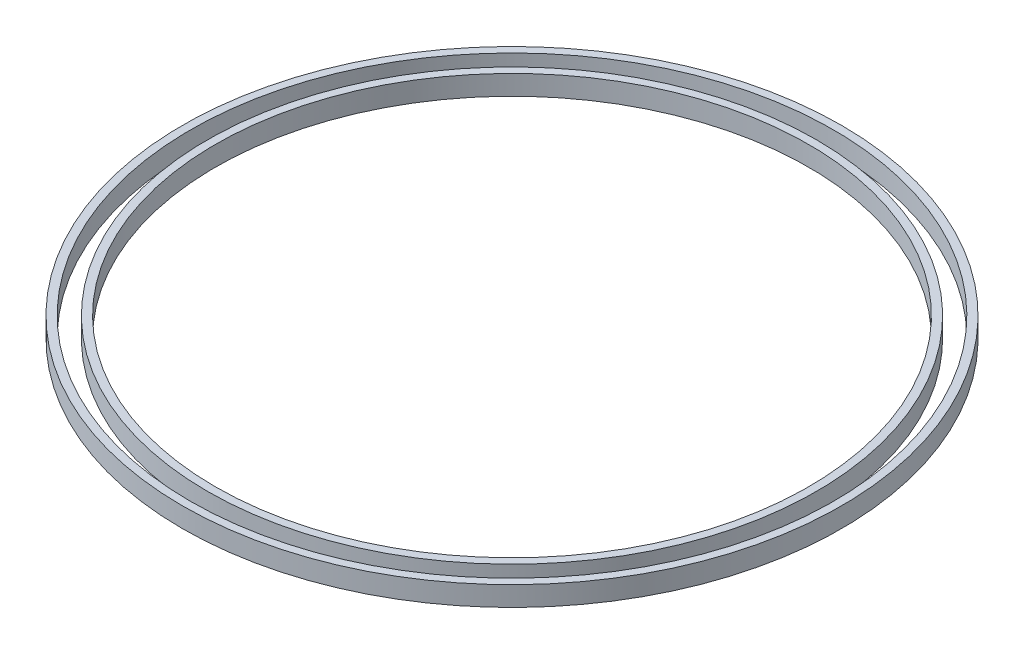
from build123d import *

# Parameters (mm, degrees)
SKETCH1_R           = 46.2
SKETCH1_R_2         = 45
BOSS_EXTRUDE1_DEPTH = 3
SKETCH2_R           = 50
SKETCH2_R_2         = 48.8
BOSS_EXTRUDE2_DEPTH = 3
CUT_EXTRUDE1_DEPTH  = 0.4


with BuildPart() as part:
    # Sketch1 → Boss-Extrude1 (new body)
    with BuildSketch(Plane(origin=(0, 0, 0), x_dir=(1, 0, 0), z_dir=(0, 1, 0))):
        with Locations(Location((0, 0, 0), (0, 0, 270))):
            Circle(SKETCH1_R)
        with Locations(Location((0, 0, 0), (0, 0, 270))):
            Circle(SKETCH1_R_2, mode=Mode.SUBTRACT)
    extrude(amount=BOSS_EXTRUDE1_DEPTH)


with BuildPart() as body_2:
    # Sketch2 → Boss-Extrude2 (new body)
    with BuildSketch(Plane(origin=(0, 0, 0), x_dir=(1, 0, 0), z_dir=(0, 1, 0))):
        with Locations(Location((0, 0, 0), (0, 0, 270))):
            Circle(SKETCH2_R)
        with Locations(Location((0, 0, 0), (0, 0, 270))):
            Circle(SKETCH2_R_2, mode=Mode.SUBTRACT)
    extrude(amount=BOSS_EXTRUDE2_DEPTH)

    # Sketch3 → Cut-Extrude1 (cut)
    # profile 1 of 3: a face of its own
    with BuildSketch(Plane.ZY.offset(50)):
        Polygon((-2.257111378, 2.75), (-1.794871795, 2.75), (-1.794871795, 0.25), (-2.019230769, 0.25), (-2.019230769, 2.493589744), (-2.403846154, 2.493589744), align=None)
    # profile 2 of 3: a face of its own
    with BuildSketch(Plane.ZY.offset(50)):
        Polygon((0.499298878, 2.814102564), (0.544871795, 2.814102564), (0.544871795, 1.083333333), (0.833333333, 1.083333333), (0.833333333, 0.826923077), (0.544871795, 0.826923077), (0.544871795, 0.25), (0.320512821, 0.25), (0.320512821, 0.826923077), (-0.865384615, 0.826923077), align=None)
        Polygon((0.320512821, 1.083333333), (0.320512821, 2.169070513), (-0.424679487, 1.083333333), align=None, mode=Mode.SUBTRACT)
    # profile 3 of 3: a face of its own
    with BuildSketch(Plane.ZY.offset(50)):
        Polygon((2.422375801, 2.814102564), (2.467948718, 2.814102564), (2.467948718, 1.083333333), (2.756410256, 1.083333333), (2.756410256, 0.826923077), (2.467948718, 0.826923077), (2.467948718, 0.25), (2.243589744, 0.25), (2.243589744, 0.826923077), (1.057692308, 0.826923077), align=None)
        Polygon((2.243589744, 1.083333333), (2.243589744, 2.169070513), (1.498397436, 1.083333333), align=None, mode=Mode.SUBTRACT)
    extrude(amount=-CUT_EXTRUDE1_DEPTH, mode=Mode.SUBTRACT)


solid = Compound([part.part, body_2.part])
